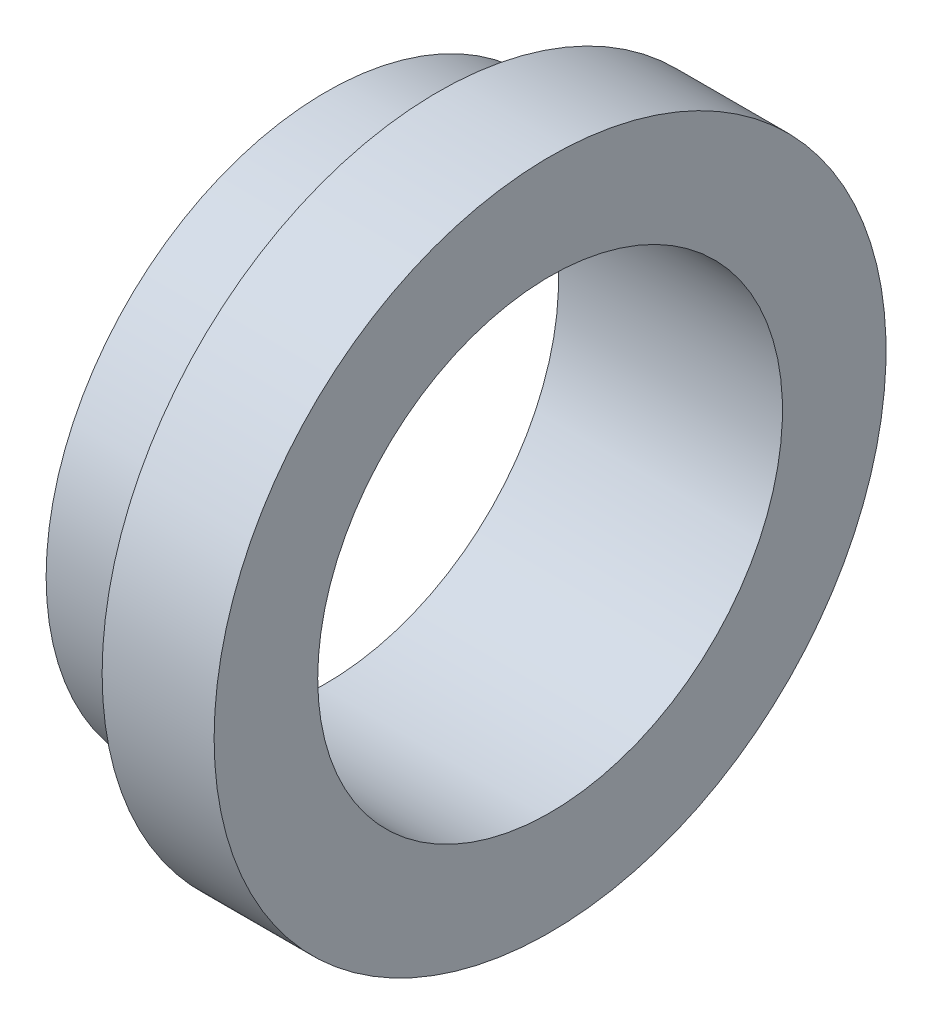
from build123d import *

# Parameters (mm, degrees)
SKETCH1_W = 2
SKETCH1_H = 0.85


with BuildPart() as part:
    # Sketch1 → Revolve1 (revolve)
    with BuildSketch(Plane.XY, mode=Mode.PRIVATE) as revolve1_sk:
        with Locations((-2, 4.575)):
            Rectangle(SKETCH1_W, SKETCH1_H)
        Polygon((1, 6), (-1, 6), (-1, 5), (-1, 4.15), (1, 4.15), align=None)
    revolve(revolve1_sk.sketch.rotate(Axis((1.997722096, 0, 0), (1, 0, 0)), 90), axis=Axis((1.997722096, 0, 0), (1, 0, 0)))


solid = part.part
